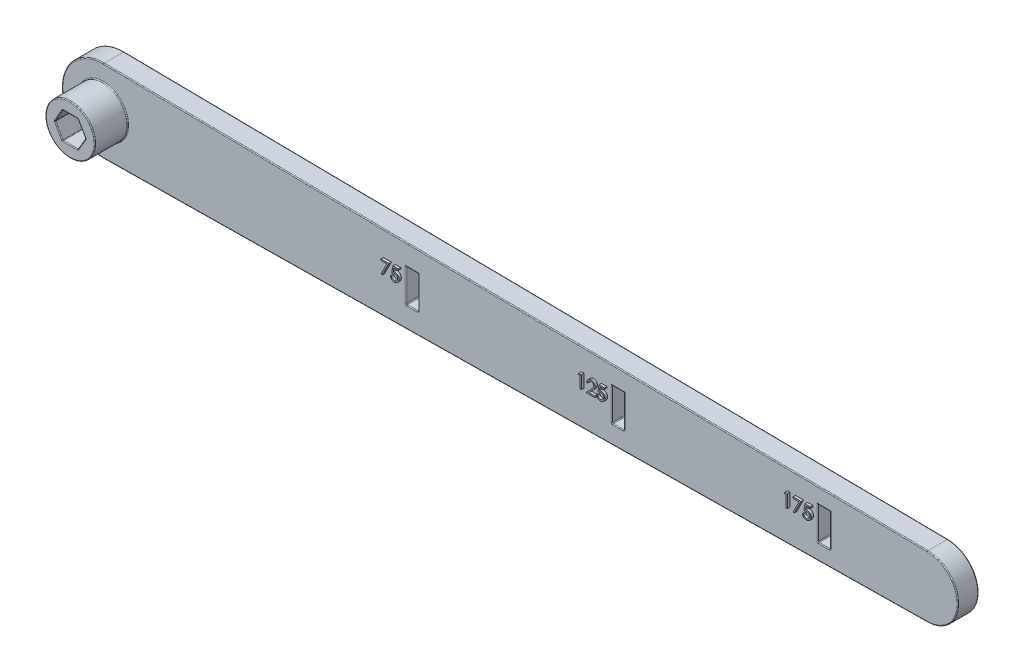
from build123d import *

# Parameters (mm, degrees)
BOSS_EXTRUDE1_DEPTH = 5
CUT_EXTRUDE2_REACH  = 209.801
CUT_EXTRUDE3_REACH  = 209.801
SKETCH4_W           = 3
SKETCH4_H           = 8
SKETCH6_R           = 6
BOSS_EXTRUDE3_DEPTH = 8
FILLET1_R           = 0.2
BOSS_EXTRUDE2_DEPTH = 0.6


with BuildPart() as part:
    # Sketch3 → Boss-Extrude1 (new body)
    with BuildSketch(Plane.XY):
        with BuildLine():
            Line((0.125, 9.999218719), (200.09375, 7.49941404))
            ThreePointArc((200.09375, 7.49941404), (207.5, 0), (200.09375, -7.49941404))
            Line((200.09375, -7.49941404), (0.125, -9.999218719))
            ThreePointArc((0.125, -9.999218719), (-10, 0), (0.125, 9.999218719))
        make_face()
    extrude(amount=BOSS_EXTRUDE1_DEPTH)

    # Sketch2 → Cut-Extrude2 (cut, up to next)
    with BuildSketch(Plane.XY, mode=Mode.PRIVATE) as cut_extrude2_sk1:
        Polygon((3.695041723, 0), (1.847520861, 3.2), (-1.847520861, 3.2), (-3.695041723, 0), (-1.847520861, -3.2), (1.847520861, -3.2), align=None)
    cut_extrude2_tool1 = extrude(cut_extrude2_sk1.sketch, amount=CUT_EXTRUDE2_REACH, mode=Mode.PRIVATE) & part.part
    add(cut_extrude2_tool1.solids().sort_by_distance((0, 0, 0))[0], mode=Mode.SUBTRACT)

    # Sketch4 → Cut-Extrude3 (cut, up to next)
    with BuildSketch(Plane.XY.offset(5), mode=Mode.PRIVATE) as cut_extrude3_sk1:
        with Locations((175, 0)):
            Rectangle(SKETCH4_W, SKETCH4_H)
    cut_extrude3_tool1 = extrude(cut_extrude3_sk1.sketch, amount=-CUT_EXTRUDE3_REACH, mode=Mode.PRIVATE) & part.part
    # Sketch4 → Cut-Extrude3 (cut, up to next)
    with BuildSketch(Plane.XY.offset(5), mode=Mode.PRIVATE) as cut_extrude3_sk2:
        with Locations((125, 0)):
            Rectangle(SKETCH4_W, SKETCH4_H)
    cut_extrude3_tool2 = extrude(cut_extrude3_sk2.sketch, amount=-CUT_EXTRUDE3_REACH, mode=Mode.PRIVATE) & part.part
    # Sketch4 → Cut-Extrude3 (cut, up to next)
    with BuildSketch(Plane.XY.offset(5), mode=Mode.PRIVATE) as cut_extrude3_sk3:
        with Locations((75, 0)):
            Rectangle(SKETCH4_W, SKETCH4_H)
    cut_extrude3_tool3 = extrude(cut_extrude3_sk3.sketch, amount=-CUT_EXTRUDE3_REACH, mode=Mode.PRIVATE) & part.part
    add(cut_extrude3_tool1.solids().sort_by_distance((175, 0, 5))[0], mode=Mode.SUBTRACT)
    add(cut_extrude3_tool2.solids().sort_by_distance((125, 0, 5))[0], mode=Mode.SUBTRACT)
    add(cut_extrude3_tool3.solids().sort_by_distance((75, 0, 5))[0], mode=Mode.SUBTRACT)

    # Sketch6 → Boss-Extrude3 (add)
    with BuildSketch(Plane.XY.offset(5)):
        Circle(SKETCH6_R)
        Polygon((3.695041723, 0), (1.847520861, 3.2), (-1.847520861, 3.2), (-3.695041723, 0), (-1.847520861, -3.2), (1.847520861, -3.2), align=None, mode=Mode.SUBTRACT)
    extrude(amount=BOSS_EXTRUDE3_DEPTH)

    # Fillet1
    fillet1_edges = [part.edges().sort_by_distance(p)[0] for p in [
        (207.5, 0, 5),
        (100.109375, 8.74931638, 5),
        (1.847520861, -3.2, 6.5),
        (2.771281292, -1.6, 0),
        (3.695041723, 0, 6.5),
        (2.771281292, 1.6, 0),
        (1.847520861, 3.2, 6.5),
        (0, 3.2, 0),
        (-1.847520861, 3.2, 6.5),
        (-2.771281292, 1.6, 0),
        (-3.695041723, 0, 6.5),
        (-2.771281292, -1.6, 0),
        (-1.847520861, -3.2, 6.5),
        (0, -3.2, 0),
        (173.5, -4, 2.5),
        (176.5, -4, 2.5),
        (173.5, 0, 5),
        (175, -4, 5),
        (176.5, 0, 5),
        (175, 4, 5),
        (-10, 0, 5),
        (100.109375, 8.74931638, 0),
        (175, -4, 0),
        (173.5, 0, 0),
        (175, 4, 0),
        (176.5, 0, 0),
        (123.5, -4, 2.5),
        (126.5, -4, 2.5),
        (207.5, 0, 0),
        (123.5, 0, 5),
        (125, -4, 5),
        (126.5, 0, 5),
        (125, 4, 5),
        (125, -4, 0),
        (123.5, 0, 0),
        (125, 4, 0),
        (126.5, 0, 0),
        (100.109375, -8.74931638, 0),
        (73.5, -4, 2.5),
        (76.5, -4, 2.5),
        (73.5, 0, 5),
        (75, -4, 5),
        (76.5, 0, 5),
        (75, 4, 5),
        (75, -4, 0),
        (73.5, 0, 0),
        (75, 4, 0),
        (76.5, 0, 0),
        (-10, 0, 0),
        (-6, 0, 13),
        (-6, 0, 5),
        (2.771281292, -1.6, 13),
        (2.771281292, 1.6, 13),
        (0, 3.2, 13),
        (-2.771281292, 1.6, 13),
        (-2.771281292, -1.6, 13),
        (0, -3.2, 13),
        (100.109375, -8.74931638, 5),
    ]]
    fillet(fillet1_edges, radius=FILLET1_R)

    # Sketch5 → Boss-Extrude2 (add)
    with BuildSketch(Plane.XY.offset(5)):
        Polygon((68.025641026, 3.175), (69.979487179, 3.175), (68.310576923, -0.081410256), (68.064438101, 0.054061498), (69.497385817, 2.849358974), (68.025641026, 2.849358974), align=None)
        with BuildLine():
            Line((72.258974359, 3.175), (72.258974359, 2.849358974))
            Line((72.258974359, 2.849358974), (71.179016426, 2.849358974))
            Line((71.179016426, 2.849358974), (71.007927684, 2.014267829))
            add(Edge.make_bspline(
                [(71.007927684, 2.014267829), (71.041542656, 2.023548147), (71.106666347, 2.041527295), (71.202787078, 2.061489672), (71.294038577, 2.073523325), (71.353252663, 2.075166443), (71.38190605, 2.075961538)],
                knots=[0, 0, 0, 0, 1.100273476, 2.13160584, 3.095893838, 4, 4, 4, 4], degree=3))
            add(Edge.make_bspline(
                [(71.38190605, 2.075961538), (71.417360585, 2.075194154), (71.48707306, 2.073685284), (71.589071247, 2.059196535), (71.686437515, 2.036391041), (71.778968236, 2.004531711), (71.866834593, 1.963792167), (71.949228167, 1.912901507), (72.027385702, 1.853453414), (72.099905055, 1.785104724), (72.165694963, 1.709882972), (72.223539825, 1.629004046), (72.272673032, 1.543253952), (72.31218886, 1.4518134), (72.34374322, 1.355693311), (72.364745387, 1.253882325), (72.378730544, 1.147340102), (72.380292995, 1.074492385), (72.381089744, 1.037344752)],
                knots=[0, 0, 0, 0, 1.052922333, 2.070308379, 3.05430497, 4.020497103, 4.973039431, 5.925935799, 6.892292201, 7.88610001, 8.88166317, 9.857072816, 10.836096531, 11.812156883, 12.81219415, 13.836441305, 14.89672472, 16, 16, 16, 16], degree=3))
            add(Edge.make_bspline(
                [(72.381089744, 1.037344752), (72.380486425, 1.011471023), (72.379287942, 0.960073227), (72.373193223, 0.883742417), (72.361458681, 0.809027561), (72.345703674, 0.735918748), (72.325254481, 0.664554389), (72.30049941, 0.594730218), (72.270204442, 0.526880824), (72.236974552, 0.460364216), (72.199558104, 0.396684142), (72.158030458, 0.337131132), (72.114156048, 0.28081182), (72.066947077, 0.228330219), (72.015964746, 0.180031196), (71.96182649, 0.135628112), (71.904964309, 0.094370048), (71.844498482, 0.057931757), (71.781776373, 0.024401075), (71.715892204, -0.003106705), (71.648345712, -0.027699827), (71.578164718, -0.047302756), (71.505508188, -0.062663002), (71.430256356, -0.073095689), (71.352803891, -0.080694315), (71.300302986, -0.081169982), (71.273783053, -0.081410256)],
                knots=[0, 0, 0, 0, 1.056347294, 2.098418968, 3.122841568, 4.141288669, 5.149314143, 6.15115421, 7.162517403, 8.180376062, 9.185164535, 10.17417709, 11.141909838, 12.097768115, 13.052685741, 14.0056014, 14.954263652, 15.917497458, 16.885230207, 17.854509472, 18.828990115, 19.81800267, 20.826176721, 21.857883937, 22.917946725, 24, 24, 24, 24], degree=3))
            add(Edge.make_bspline(
                [(71.273783053, -0.081410256), (71.242147189, -0.080783568), (71.179907364, -0.079550632), (71.08872085, -0.066652434), (71.000986886, -0.048179453), (70.917411723, -0.02038798), (70.837246362, 0.014434781), (70.761570039, 0.058445879), (70.688449085, 0.10831978), (70.620856024, 0.167175529), (70.558121549, 0.231506183), (70.501963502, 0.301317758), (70.451949471, 0.375458038), (70.408880372, 0.454287077), (70.372142882, 0.537597745), (70.343282142, 0.625702181), (70.319988206, 0.718140042), (70.310133532, 0.781779298), (70.305128205, 0.814102564)],
                knots=[0, 0, 0, 0, 1.0467383, 2.05933395, 3.04377827, 4.011590433, 4.970194871, 5.932262533, 6.905835911, 7.896367577, 8.894135286, 9.877477877, 10.858688626, 11.851381753, 12.8477658, 13.868841284, 14.917554742, 16, 16, 16, 16], degree=3))
            Line((70.305128205, 0.814102564), (70.590064103, 0.814102564))
            add(Edge.make_bspline(
                [(70.590064103, 0.814102564), (70.597075008, 0.783825354), (70.610550358, 0.725630874), (70.64012843, 0.643868872), (70.676292474, 0.571007861), (70.71929499, 0.506084025), (70.770593947, 0.449470149), (70.829131357, 0.399017529), (70.894761078, 0.353501518), (70.967689221, 0.315562294), (71.044626801, 0.283205639), (71.125151341, 0.261659459), (71.207070284, 0.246509363), (71.262477091, 0.244992837), (71.290319511, 0.244230769)],
                knots=[0, 0, 0, 0, 1.136247022, 2.183929868, 3.172523383, 4.106158343, 5.02341133, 5.958108904, 6.928429099, 7.938127109, 8.96079061, 9.975095812, 10.982467395, 12, 12, 12, 12], degree=3))
            add(Edge.make_bspline(
                [(71.290319511, 0.244230769), (71.3174961, 0.244975332), (71.371007026, 0.246441382), (71.449757355, 0.257725343), (71.525787605, 0.275103997), (71.598347565, 0.301111651), (71.668706961, 0.332720789), (71.735086025, 0.37328375), (71.799405063, 0.419965339), (71.85966487, 0.473447424), (71.914854942, 0.532384219), (71.963619423, 0.59541014), (72.00423848, 0.662644708), (72.038468708, 0.732923925), (72.064461343, 0.807018045), (72.083004233, 0.884579825), (72.093892722, 0.965800843), (72.095390578, 1.021199431), (72.096153846, 1.049429087)],
                knots=[0, 0, 0, 0, 1.027316725, 2.022795036, 3.002884548, 3.971462791, 4.93288096, 5.914575861, 6.907176829, 7.935150275, 8.956128384, 9.956726525, 10.942570165, 11.921478529, 12.907843606, 13.90538589, 14.932640048, 16, 16, 16, 16], degree=3))
            add(Edge.make_bspline(
                [(72.096153846, 1.049429087), (72.095556511, 1.074897804), (72.094387313, 1.124749195), (72.084834581, 1.197682761), (72.068218471, 1.266691878), (72.04515538, 1.33210979), (72.015873255, 1.393998198), (71.980089814, 1.452420974), (71.937133518, 1.506608094), (71.888064447, 1.556584911), (71.834308939, 1.602708476), (71.774942115, 1.642027754), (71.711206324, 1.675105737), (71.643869473, 1.703651707), (71.571329887, 1.724153812), (71.495024085, 1.739546108), (71.414128071, 1.748450044), (71.358818947, 1.749685471), (71.330388622, 1.750320513)],
                knots=[0, 0, 0, 0, 1.045622112, 2.046656509, 3.013763289, 3.955457236, 4.890082067, 5.820317437, 6.762574623, 7.722996705, 8.69280354, 9.665887285, 10.63943826, 11.638615906, 12.663482002, 13.728887084, 14.832589034, 16, 16, 16, 16], degree=3))
            add(Edge.make_bspline(
                [(71.330388622, 1.750320513), (71.305778808, 1.749793834), (71.254965785, 1.748706375), (71.177021507, 1.740699481), (71.095114015, 1.727782407), (71.009557294, 1.710014883), (70.920094405, 1.686763834), (70.826914141, 1.658901395), (70.729820585, 1.625589296), (70.664399507, 1.600432216), (70.630769231, 1.5875)],
                knots=[0, 0, 0, 0, 0.817624296, 1.688186739, 2.600797293, 3.572016777, 4.590301741, 5.671205678, 6.80286297, 8, 8, 8, 8], degree=3))
            Line((70.630769231, 1.5875), (70.956410256, 3.175))
            Line((70.956410256, 3.175), (72.258974359, 3.175))
        make_face()
        Polygon((116.096930088, 3.175), (116.683974359, 3.175), (116.683974359, 0), (116.399038462, 0), (116.399038462, 2.849358974), (115.910576923, 2.849358974), align=None)
        with BuildLine():
            Line((118.271474359, 2.198076923), (117.986538462, 2.198076923))
            add(Edge.make_bspline(
                [(117.986538462, 2.198076923), (117.988395522, 2.235878371), (117.992042739, 2.310119409), (118.009122687, 2.418363239), (118.033561911, 2.521827235), (118.068116301, 2.619680657), (118.111029853, 2.712788718), (118.162492093, 2.800781589), (118.223446514, 2.883323596), (118.292576909, 2.959649547), (118.367659888, 3.0296697), (118.448673133, 3.090135528), (118.53380398, 3.141223701), (118.622794149, 3.183933113), (118.71664766, 3.215991402), (118.814512824, 3.239778175), (118.916819612, 3.254089574), (118.986524489, 3.255627894), (119.02197516, 3.256410256)],
                knots=[0, 0, 0, 0, 1.10065271, 2.161652631, 3.183658789, 4.190468796, 5.17591951, 6.163126047, 7.15150782, 8.156236427, 9.156009102, 10.134482811, 11.092018607, 12.041330605, 13.001268258, 13.972401359, 14.968799086, 16, 16, 16, 16], degree=3))
            add(Edge.make_bspline(
                [(119.02197516, 3.256410256), (119.056789556, 3.255595228), (119.1251986, 3.253993726), (119.22504057, 3.240240507), (119.320088545, 3.218699863), (119.410156733, 3.188478021), (119.49452652, 3.147852148), (119.57383171, 3.099050095), (119.649016446, 3.042607819), (119.716695457, 2.976156146), (119.778842071, 2.905215411), (119.83245626, 2.829479956), (119.87836963, 2.751257675), (119.916639882, 2.669952092), (119.944812237, 2.584797659), (119.96620104, 2.497034125), (119.978290908, 2.405753047), (119.980146399, 2.343970671), (119.981089744, 2.312560096)],
                knots=[0, 0, 0, 0, 1.111607364, 2.184268762, 3.212621178, 4.221274766, 5.211760367, 6.196651075, 7.1921475, 8.207485113, 9.220403448, 10.201281604, 11.166441695, 12.114753415, 13.065576456, 14.026450734, 14.996634279, 16, 16, 16, 16], degree=3))
            add(Edge.make_bspline(
                [(119.981089744, 2.312560096), (119.979553712, 2.268338846), (119.976508605, 2.180672367), (119.950460563, 2.051844598), (119.909778371, 1.927027711), (119.860795054, 1.826573158), (119.811380766, 1.745625632), (119.766851384, 1.678979021), (119.714722591, 1.60721906), (119.654235668, 1.530586047), (119.586641848, 1.448479726), (119.511328886, 1.360949697), (119.427759727, 1.268900306), (119.36910523, 1.206030225), (119.338711939, 1.173452524)],
                knots=[0, 0, 0, 0, 1.184426356, 2.348067706, 3.509069118, 4.696110526, 5.333549288, 6.050745305, 6.844228056, 7.710549037, 8.667450064, 9.695053472, 10.805634456, 12, 12, 12, 12], degree=3))
            Line((119.338711939, 1.173452524), (118.544325921, 0.325641026))
            Line((118.544325921, 0.325641026), (120.021794872, 0.325641026))
            Line((120.021794872, 0.325641026), (120.021794872, 0))
            Line((120.021794872, 0), (117.864423077, 0))
            Line((117.864423077, 0), (119.095753205, 1.31401242))
            add(Edge.make_bspline(
                [(119.095753205, 1.31401242), (119.12573236, 1.345307312), (119.18331618, 1.405418396), (119.264761803, 1.493178081), (119.337912885, 1.574593736), (119.403242949, 1.649511533), (119.459334772, 1.719027313), (119.509111725, 1.780889651), (119.548994797, 1.837816902), (119.592279477, 1.903803031), (119.63420216, 1.98436849), (119.67022694, 2.082824051), (119.692193267, 2.18417663), (119.694828368, 2.252667764), (119.696153846, 2.287119391)],
                knots=[0, 0, 0, 0, 1.329631726, 2.553950428, 3.673215718, 4.687767853, 5.603093632, 6.413772471, 7.123043292, 7.734684054, 8.834405432, 9.900288307, 10.943827018, 12, 12, 12, 12], degree=3))
            add(Edge.make_bspline(
                [(119.696153846, 2.287119391), (119.695577137, 2.308783231), (119.694440554, 2.3514785), (119.684409643, 2.414076581), (119.669250827, 2.474460376), (119.647529057, 2.532815624), (119.618857228, 2.588555608), (119.583956377, 2.641748179), (119.543688248, 2.693173169), (119.49710531, 2.741390804), (119.445932003, 2.785551612), (119.391871505, 2.824671318), (119.334676054, 2.85736394), (119.2745868, 2.884164112), (119.211771267, 2.905187494), (119.146107962, 2.919754919), (119.077778319, 2.928901173), (119.031120791, 2.930138671), (119.007346755, 2.930769231)],
                knots=[0, 0, 0, 0, 0.991446411, 1.95395049, 2.89581595, 3.838931463, 4.798493298, 5.75982156, 6.748411868, 7.785213223, 8.824556874, 9.840280684, 10.836137867, 11.835679398, 12.848801643, 13.863922112, 14.911575587, 16, 16, 16, 16], degree=3))
            add(Edge.make_bspline(
                [(119.007346755, 2.930769231), (118.982517499, 2.930120594), (118.933756941, 2.92884678), (118.862166104, 2.91993622), (118.793871149, 2.904563922), (118.72870028, 2.883539367), (118.666543227, 2.856816255), (118.607702273, 2.823531601), (118.552309509, 2.783813718), (118.500260806, 2.738782642), (118.452305625, 2.688647032), (118.410171673, 2.632757994), (118.373356174, 2.572135982), (118.341234941, 2.506944568), (118.315149422, 2.436592211), (118.295216636, 2.36132865), (118.279444282, 2.281480682), (118.274175124, 2.226339927), (118.271474359, 2.198076923)],
                knots=[0, 0, 0, 0, 1.031018746, 2.02475058, 2.990194455, 3.934040569, 4.864654155, 5.795059489, 6.735614925, 7.690564532, 8.649604399, 9.611025574, 10.590972636, 11.591080095, 12.624614302, 13.701020113, 14.821632451, 16, 16, 16, 16], degree=3))
        make_face()
        with BuildLine():
            Line((122.301282051, 3.175), (122.301282051, 2.849358974))
            Line((122.301282051, 2.849358974), (121.221324119, 2.849358974))
            Line((121.221324119, 2.849358974), (121.050235377, 2.014267829))
            add(Edge.make_bspline(
                [(121.050235377, 2.014267829), (121.083850348, 2.023548147), (121.14897404, 2.041527295), (121.245094771, 2.061489672), (121.336346269, 2.073523325), (121.395560355, 2.075166443), (121.424213742, 2.075961538)],
                knots=[0, 0, 0, 0, 1.100273476, 2.13160584, 3.095893838, 4, 4, 4, 4], degree=3))
            add(Edge.make_bspline(
                [(121.424213742, 2.075961538), (121.459668277, 2.075194154), (121.529380752, 2.073685284), (121.63137894, 2.059196535), (121.728745207, 2.036391041), (121.821275929, 2.004531711), (121.909142285, 1.963792167), (121.991535859, 1.912901507), (122.069693394, 1.853453414), (122.142212747, 1.785104724), (122.208002655, 1.709882972), (122.265847517, 1.629004046), (122.314980724, 1.543253952), (122.354496552, 1.4518134), (122.386050912, 1.355693311), (122.407053079, 1.253882325), (122.421038237, 1.147340102), (122.422600687, 1.074492385), (122.423397436, 1.037344752)],
                knots=[0, 0, 0, 0, 1.052922333, 2.070308379, 3.05430497, 4.020497103, 4.973039431, 5.925935799, 6.892292201, 7.88610001, 8.88166317, 9.857072816, 10.836096531, 11.812156883, 12.81219415, 13.836441305, 14.89672472, 16, 16, 16, 16], degree=3))
            add(Edge.make_bspline(
                [(122.423397436, 1.037344752), (122.422794118, 1.011471023), (122.421595634, 0.960073227), (122.415500916, 0.883742417), (122.403766373, 0.809027561), (122.388011366, 0.735918748), (122.367562173, 0.664554389), (122.342807103, 0.594730218), (122.312512135, 0.526880824), (122.279282244, 0.460364216), (122.241865796, 0.396684142), (122.20033815, 0.337131132), (122.156463741, 0.28081182), (122.109254769, 0.228330219), (122.058272438, 0.180031196), (122.004134182, 0.135628112), (121.947272002, 0.094370048), (121.886806175, 0.057931757), (121.824084065, 0.024401075), (121.758199897, -0.003106705), (121.690653404, -0.027699827), (121.62047241, -0.047302756), (121.54781588, -0.062663002), (121.472564048, -0.073095689), (121.395111583, -0.080694315), (121.342610679, -0.081169982), (121.316090745, -0.081410256)],
                knots=[0, 0, 0, 0, 1.056347294, 2.098418968, 3.122841568, 4.141288669, 5.149314143, 6.15115421, 7.162517403, 8.180376062, 9.185164535, 10.17417709, 11.141909838, 12.097768115, 13.052685741, 14.0056014, 14.954263652, 15.917497458, 16.885230207, 17.854509472, 18.828990115, 19.81800267, 20.826176721, 21.857883937, 22.917946725, 24, 24, 24, 24], degree=3))
            add(Edge.make_bspline(
                [(121.316090745, -0.081410256), (121.284454881, -0.080783568), (121.222215056, -0.079550632), (121.131028542, -0.066652434), (121.043294578, -0.048179453), (120.959719415, -0.02038798), (120.879554054, 0.014434781), (120.803877732, 0.058445879), (120.730756778, 0.10831978), (120.663163716, 0.167175529), (120.600429241, 0.231506183), (120.544271194, 0.301317758), (120.494257164, 0.375458038), (120.451188065, 0.454287077), (120.414450574, 0.537597745), (120.385589835, 0.625702181), (120.362295898, 0.718140042), (120.352441224, 0.781779298), (120.347435897, 0.814102564)],
                knots=[0, 0, 0, 0, 1.0467383, 2.05933395, 3.04377827, 4.011590433, 4.970194871, 5.932262533, 6.905835911, 7.896367577, 8.894135286, 9.877477877, 10.858688626, 11.851381753, 12.8477658, 13.868841284, 14.917554742, 16, 16, 16, 16], degree=3))
            Line((120.347435897, 0.814102564), (120.632371795, 0.814102564))
            add(Edge.make_bspline(
                [(120.632371795, 0.814102564), (120.639382701, 0.783825354), (120.65285805, 0.725630874), (120.682436123, 0.643868872), (120.718600167, 0.571007861), (120.761602683, 0.506084025), (120.812901639, 0.449470149), (120.87143905, 0.399017529), (120.93706877, 0.353501518), (121.009996914, 0.315562294), (121.086934493, 0.283205639), (121.167459033, 0.261659459), (121.249377976, 0.246509363), (121.304784783, 0.244992837), (121.332627204, 0.244230769)],
                knots=[0, 0, 0, 0, 1.136247022, 2.183929868, 3.172523383, 4.106158343, 5.02341133, 5.958108904, 6.928429099, 7.938127109, 8.96079061, 9.975095812, 10.982467395, 12, 12, 12, 12], degree=3))
            add(Edge.make_bspline(
                [(121.332627204, 0.244230769), (121.359803792, 0.244975332), (121.413314718, 0.246441382), (121.492065048, 0.257725343), (121.568095298, 0.275103997), (121.640655257, 0.301111651), (121.711014654, 0.332720789), (121.777393717, 0.37328375), (121.841712755, 0.419965339), (121.901972562, 0.473447424), (121.957162634, 0.532384219), (122.005927115, 0.59541014), (122.046546173, 0.662644708), (122.0807764, 0.732923925), (122.106769035, 0.807018045), (122.125311925, 0.884579825), (122.136200414, 0.965800843), (122.137698271, 1.021199431), (122.138461538, 1.049429087)],
                knots=[0, 0, 0, 0, 1.027316725, 2.022795036, 3.002884548, 3.971462791, 4.93288096, 5.914575861, 6.907176829, 7.935150275, 8.956128384, 9.956726525, 10.942570165, 11.921478529, 12.907843606, 13.90538589, 14.932640048, 16, 16, 16, 16], degree=3))
            add(Edge.make_bspline(
                [(122.138461538, 1.049429087), (122.137864204, 1.074897804), (122.136695005, 1.124749195), (122.127142274, 1.197682761), (122.110526163, 1.266691878), (122.087463072, 1.33210979), (122.058180947, 1.393998198), (122.022397507, 1.452420974), (121.97944121, 1.506608094), (121.93037214, 1.556584911), (121.876616631, 1.602708476), (121.817249807, 1.642027754), (121.753514017, 1.675105737), (121.686177166, 1.703651707), (121.613637579, 1.724153812), (121.537331777, 1.739546108), (121.456435763, 1.748450044), (121.401126639, 1.749685471), (121.372696314, 1.750320513)],
                knots=[0, 0, 0, 0, 1.045622112, 2.046656509, 3.013763289, 3.955457236, 4.890082067, 5.820317437, 6.762574623, 7.722996705, 8.69280354, 9.665887285, 10.63943826, 11.638615906, 12.663482002, 13.728887084, 14.832589034, 16, 16, 16, 16], degree=3))
            add(Edge.make_bspline(
                [(121.372696314, 1.750320513), (121.3480865, 1.749793834), (121.297273478, 1.748706375), (121.219329199, 1.740699481), (121.137421708, 1.727782407), (121.051864987, 1.710014883), (120.962402097, 1.686763834), (120.869221834, 1.658901395), (120.772128278, 1.625589296), (120.706707199, 1.600432216), (120.673076923, 1.5875)],
                knots=[0, 0, 0, 0, 0.817624296, 1.688186739, 2.600797293, 3.572016777, 4.590301741, 5.671205678, 6.80286297, 8, 8, 8, 8], degree=3))
            Line((120.673076923, 1.5875), (120.998717949, 3.175))
            Line((120.998717949, 3.175), (122.301282051, 3.175))
        make_face()
        Polygon((166.096930088, 3.175), (166.683974359, 3.175), (166.683974359, 0), (166.399038462, 0), (166.399038462, 2.849358974), (165.910576923, 2.849358974), align=None)
        Polygon((168.067948718, 3.175), (170.021794872, 3.175), (168.352884615, -0.081410256), (168.106745793, 0.054061498), (169.53969351, 2.849358974), (168.067948718, 2.849358974), align=None)
        with BuildLine():
            Line((172.301282051, 3.175), (172.301282051, 2.849358974))
            Line((172.301282051, 2.849358974), (171.221324119, 2.849358974))
            Line((171.221324119, 2.849358974), (171.050235377, 2.014267829))
            add(Edge.make_bspline(
                [(171.050235377, 2.014267829), (171.083850348, 2.023548147), (171.14897404, 2.041527295), (171.245094771, 2.061489672), (171.336346269, 2.073523325), (171.395560355, 2.075166443), (171.424213742, 2.075961538)],
                knots=[0, 0, 0, 0, 1.100273476, 2.13160584, 3.095893838, 4, 4, 4, 4], degree=3))
            add(Edge.make_bspline(
                [(171.424213742, 2.075961538), (171.459668277, 2.075194154), (171.529380752, 2.073685284), (171.63137894, 2.059196535), (171.728745207, 2.036391041), (171.821275929, 2.004531711), (171.909142285, 1.963792167), (171.991535859, 1.912901507), (172.069693394, 1.853453414), (172.142212747, 1.785104724), (172.208002655, 1.709882972), (172.265847517, 1.629004046), (172.314980724, 1.543253952), (172.354496552, 1.4518134), (172.386050912, 1.355693311), (172.407053079, 1.253882325), (172.421038237, 1.147340102), (172.422600687, 1.074492385), (172.423397436, 1.037344752)],
                knots=[0, 0, 0, 0, 1.052922333, 2.070308379, 3.05430497, 4.020497103, 4.973039431, 5.925935799, 6.892292201, 7.88610001, 8.88166317, 9.857072816, 10.836096531, 11.812156883, 12.81219415, 13.836441305, 14.89672472, 16, 16, 16, 16], degree=3))
            add(Edge.make_bspline(
                [(172.423397436, 1.037344752), (172.422794118, 1.011471023), (172.421595634, 0.960073227), (172.415500916, 0.883742417), (172.403766373, 0.809027561), (172.388011366, 0.735918748), (172.367562173, 0.664554389), (172.342807103, 0.594730218), (172.312512135, 0.526880824), (172.279282244, 0.460364216), (172.241865796, 0.396684142), (172.20033815, 0.337131132), (172.156463741, 0.28081182), (172.109254769, 0.228330219), (172.058272438, 0.180031196), (172.004134182, 0.135628112), (171.947272002, 0.094370048), (171.886806175, 0.057931757), (171.824084065, 0.024401075), (171.758199897, -0.003106705), (171.690653404, -0.027699827), (171.62047241, -0.047302756), (171.54781588, -0.062663002), (171.472564048, -0.073095689), (171.395111583, -0.080694315), (171.342610679, -0.081169982), (171.316090745, -0.081410256)],
                knots=[0, 0, 0, 0, 1.056347294, 2.098418968, 3.122841568, 4.141288669, 5.149314143, 6.15115421, 7.162517403, 8.180376062, 9.185164535, 10.17417709, 11.141909838, 12.097768115, 13.052685741, 14.0056014, 14.954263652, 15.917497458, 16.885230207, 17.854509472, 18.828990115, 19.81800267, 20.826176721, 21.857883937, 22.917946725, 24, 24, 24, 24], degree=3))
            add(Edge.make_bspline(
                [(171.316090745, -0.081410256), (171.284454881, -0.080783568), (171.222215056, -0.079550632), (171.131028542, -0.066652434), (171.043294578, -0.048179453), (170.959719415, -0.02038798), (170.879554054, 0.014434781), (170.803877732, 0.058445879), (170.730756778, 0.10831978), (170.663163716, 0.167175529), (170.600429241, 0.231506183), (170.544271194, 0.301317758), (170.494257164, 0.375458038), (170.451188065, 0.454287077), (170.414450574, 0.537597745), (170.385589835, 0.625702181), (170.362295898, 0.718140042), (170.352441224, 0.781779298), (170.347435897, 0.814102564)],
                knots=[0, 0, 0, 0, 1.0467383, 2.05933395, 3.04377827, 4.011590433, 4.970194871, 5.932262533, 6.905835911, 7.896367577, 8.894135286, 9.877477877, 10.858688626, 11.851381753, 12.8477658, 13.868841284, 14.917554742, 16, 16, 16, 16], degree=3))
            Line((170.347435897, 0.814102564), (170.632371795, 0.814102564))
            add(Edge.make_bspline(
                [(170.632371795, 0.814102564), (170.639382701, 0.783825354), (170.65285805, 0.725630874), (170.682436123, 0.643868872), (170.718600167, 0.571007861), (170.761602683, 0.506084025), (170.812901639, 0.449470149), (170.87143905, 0.399017529), (170.93706877, 0.353501518), (171.009996914, 0.315562294), (171.086934493, 0.283205639), (171.167459033, 0.261659459), (171.249377976, 0.246509363), (171.304784783, 0.244992837), (171.332627204, 0.244230769)],
                knots=[0, 0, 0, 0, 1.136247022, 2.183929868, 3.172523383, 4.106158343, 5.02341133, 5.958108904, 6.928429099, 7.938127109, 8.96079061, 9.975095812, 10.982467395, 12, 12, 12, 12], degree=3))
            add(Edge.make_bspline(
                [(171.332627204, 0.244230769), (171.359803792, 0.244975332), (171.413314718, 0.246441382), (171.492065048, 0.257725343), (171.568095298, 0.275103997), (171.640655257, 0.301111651), (171.711014654, 0.332720789), (171.777393717, 0.37328375), (171.841712755, 0.419965339), (171.901972562, 0.473447424), (171.957162634, 0.532384219), (172.005927115, 0.59541014), (172.046546173, 0.662644708), (172.0807764, 0.732923925), (172.106769035, 0.807018045), (172.125311925, 0.884579825), (172.136200414, 0.965800843), (172.137698271, 1.021199431), (172.138461538, 1.049429087)],
                knots=[0, 0, 0, 0, 1.027316725, 2.022795036, 3.002884548, 3.971462791, 4.93288096, 5.914575861, 6.907176829, 7.935150275, 8.956128384, 9.956726525, 10.942570165, 11.921478529, 12.907843606, 13.90538589, 14.932640048, 16, 16, 16, 16], degree=3))
            add(Edge.make_bspline(
                [(172.138461538, 1.049429087), (172.137864204, 1.074897804), (172.136695005, 1.124749195), (172.127142274, 1.197682761), (172.110526163, 1.266691878), (172.087463072, 1.33210979), (172.058180947, 1.393998198), (172.022397507, 1.452420974), (171.97944121, 1.506608094), (171.93037214, 1.556584911), (171.876616631, 1.602708476), (171.817249807, 1.642027754), (171.753514017, 1.675105737), (171.686177166, 1.703651707), (171.613637579, 1.724153812), (171.537331777, 1.739546108), (171.456435763, 1.748450044), (171.401126639, 1.749685471), (171.372696314, 1.750320513)],
                knots=[0, 0, 0, 0, 1.045622112, 2.046656509, 3.013763289, 3.955457236, 4.890082067, 5.820317437, 6.762574623, 7.722996705, 8.69280354, 9.665887285, 10.63943826, 11.638615906, 12.663482002, 13.728887084, 14.832589034, 16, 16, 16, 16], degree=3))
            add(Edge.make_bspline(
                [(171.372696314, 1.750320513), (171.3480865, 1.749793834), (171.297273478, 1.748706375), (171.219329199, 1.740699481), (171.137421708, 1.727782407), (171.051864987, 1.710014883), (170.962402097, 1.686763834), (170.869221834, 1.658901395), (170.772128278, 1.625589296), (170.706707199, 1.600432216), (170.673076923, 1.5875)],
                knots=[0, 0, 0, 0, 0.817624296, 1.688186739, 2.600797293, 3.572016777, 4.590301741, 5.671205678, 6.80286297, 8, 8, 8, 8], degree=3))
            Line((170.673076923, 1.5875), (170.998717949, 3.175))
            Line((170.998717949, 3.175), (172.301282051, 3.175))
        make_face()
    extrude(amount=BOSS_EXTRUDE2_DEPTH)


solid = part.part
